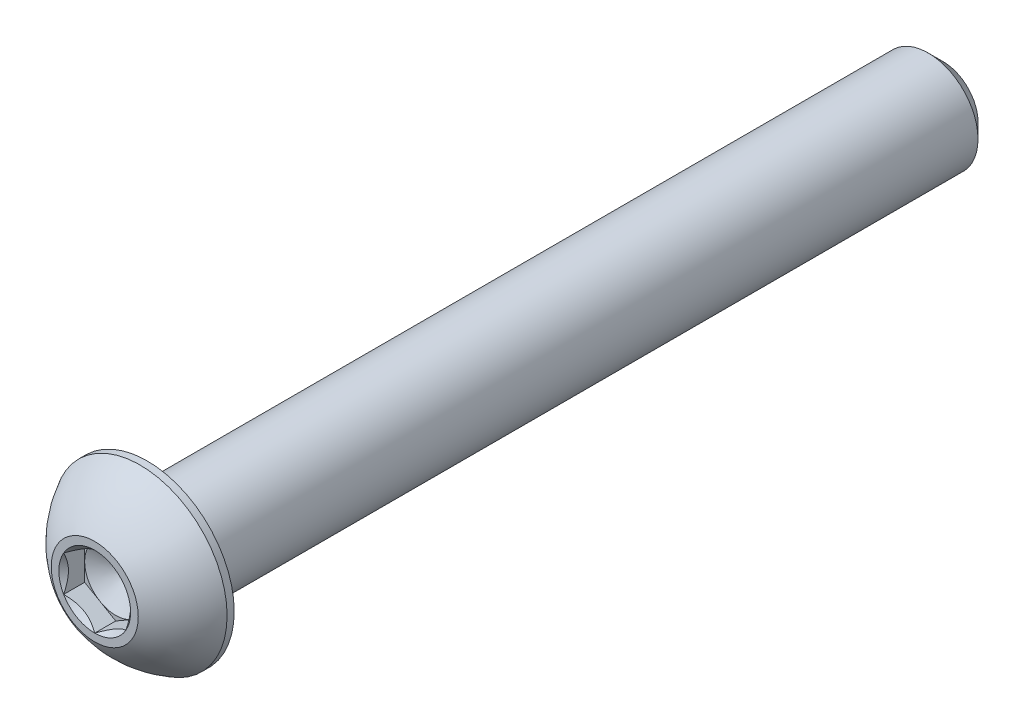
from build123d import *

# Parameters (mm, degrees)
CUT_EXTRUDE1_START = 25.73528
CUT_EXTRUDE1_DEPTH = 3.455750925


with BuildPart() as part:
    # Sketch2 → Revolve1 (revolve)
    with BuildSketch(Plane(origin=(0, 0, 0), x_dir=(0, 0, -1), z_dir=(1, 0, 0)), mode=Mode.PRIVATE) as revolve1_sk:
        with BuildLine():
            Line((-27.0764, 1.984375), (-27.0764, 2.778125))
            ThreePointArc((-27.0764, 2.778125), (-25.825106299, 4.371452392), (-24.177171429, 5.5499))
            Line((-24.177171429, 5.5499), (-23.7236, 5.5499))
            Line((-23.7236, 5.5499), (-23.7236, 3.175))
            Line((-23.7236, 3.175), (26.1239, 3.175))
            Line((26.1239, 3.175), (27.0764, 2.2225))
            Line((27.0764, 2.2225), (27.0764, 0))
            Line((27.0764, 0), (-24.58960056, 0))
            Line((-24.58960056, 0), (-25.73528, 1.984375))
            Line((-25.73528, 1.984375), (-27.0764, 1.984375))
        make_face()
    revolve(revolve1_sk.sketch.rotate(Axis((0, 0, 27.0764), (0, 0, -1)), 90), axis=Axis((0, 0, 27.0764), (0, 0, -1)))

    # Sketch3 → Cut-Extrude1 (cut, through all)
    with BuildSketch(Plane.XY.offset(CUT_EXTRUDE1_START)):
        Polygon((0, 2.291358881), (-1.984375, 1.14567944), (-1.984375, -1.14567944), (0, -2.291358881), (1.984375, -1.14567944), (1.984375, 1.14567944), align=None)
    extrude(amount=CUT_EXTRUDE1_DEPTH, mode=Mode.SUBTRACT)

    # Cut-Extrude2 cone 1 section (through the dimple's axis) → Cut-Extrude2 (revolve, cut)
    with BuildSketch(Plane(origin=(0, 0, 27.0764), x_dir=(0, -1, 0), z_dir=(1, 0, 0))):
        Polygon((0, 0), (2.291358881, 0), (0, 2.291358881), align=None)
    revolve(axis=Axis((0, 0, 27.0764), (0, 0, -1)), mode=Mode.SUBTRACT)


solid = part.part
